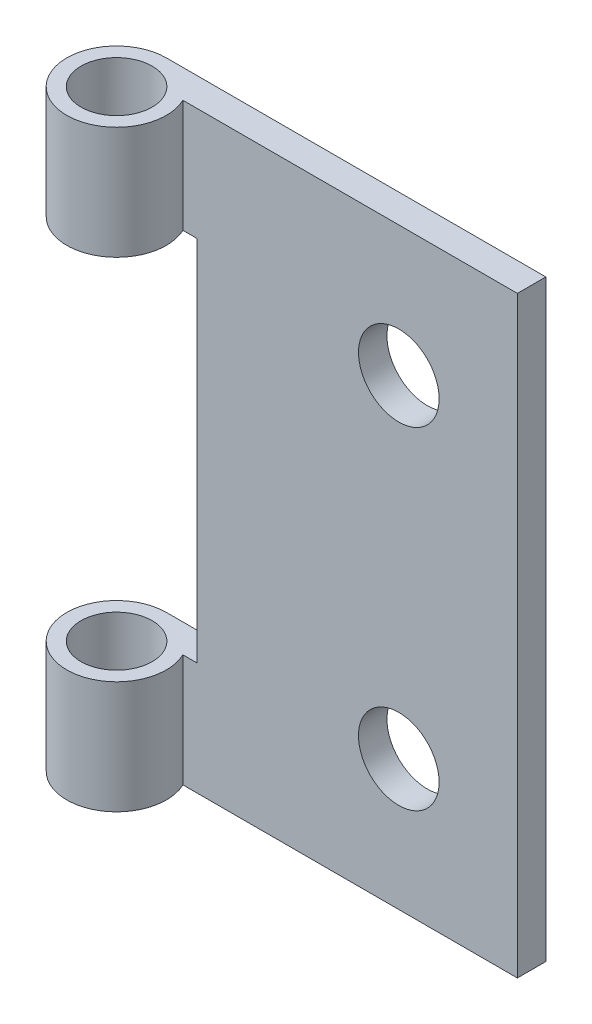
from build123d import *

# Parameters (mm, degrees)
SKETCH_1_W          = 13.5
SKETCH_1_H          = 25
SKETCH_1_W_2        = 2.5
SKETCH_1_H_2        = 4.75
EXTRUDE_1_DEPTH     = 1.2
SKETCH_2_R          = 1.7
CUT_EXTRUDE_1_DEPTH = 1.2
SKETCH_3_R          = 2.1
EXTRUDE_2_DEPTH     = 25
SKETCH_4_R          = 1.5
CUT_EXTRUDE_2_DEPTH = 25
SKETCH_5_W          = 5
SKETCH_5_H          = 15.5
CUT_EXTRUDE_3_DEPTH = 7.5


with BuildPart() as part:
    # 草图1 → 凸台-拉伸1 (new body)
    with BuildSketch(Plane.XY):
        with Locations((6.75, 0)):
            Rectangle(SKETCH_1_W, SKETCH_1_H)
        with Locations((-1.25, 10.125)):
            Rectangle(SKETCH_1_W_2, SKETCH_1_H_2)
        with Locations((-1.25, -10.125)):
            Rectangle(SKETCH_1_W_2, SKETCH_1_H_2)
    extrude(amount=EXTRUDE_1_DEPTH)

    # 草图2 → 切除-拉伸1 (cut)
    with BuildSketch(Plane.XY.offset(1.2)):
        with Locations((8.5, 7)):
            Circle(SKETCH_2_R)
        with Locations((8.5, -7)):
            Circle(SKETCH_2_R)
    extrude(amount=-CUT_EXTRUDE_1_DEPTH, mode=Mode.SUBTRACT)

    # 草图3 → 凸台-拉伸2 (add)
    with BuildSketch(Plane.XZ.offset(12.5)):
        with Locations(Location((-2.5, 2.1, 0), (0, 0, 270))):
            Circle(SKETCH_3_R)
    extrude(amount=-EXTRUDE_2_DEPTH)

    # 草图4 → 切除-拉伸2 (cut)
    with BuildSketch(Plane.XZ.offset(12.5)):
        with Locations(Location((-2.5, 2.1, 0), (0, 0, 270))):
            Circle(SKETCH_4_R)
    extrude(amount=-CUT_EXTRUDE_2_DEPTH, mode=Mode.SUBTRACT)

    # 草图5 → 切除-拉伸3 (cut, symmetric)
    with BuildSketch(Plane.XY.offset(1.2)):
        with Locations((-2.5, 0)):
            Rectangle(SKETCH_5_W, SKETCH_5_H)
    extrude(amount=CUT_EXTRUDE_3_DEPTH, both=True, mode=Mode.SUBTRACT)


solid = part.part
